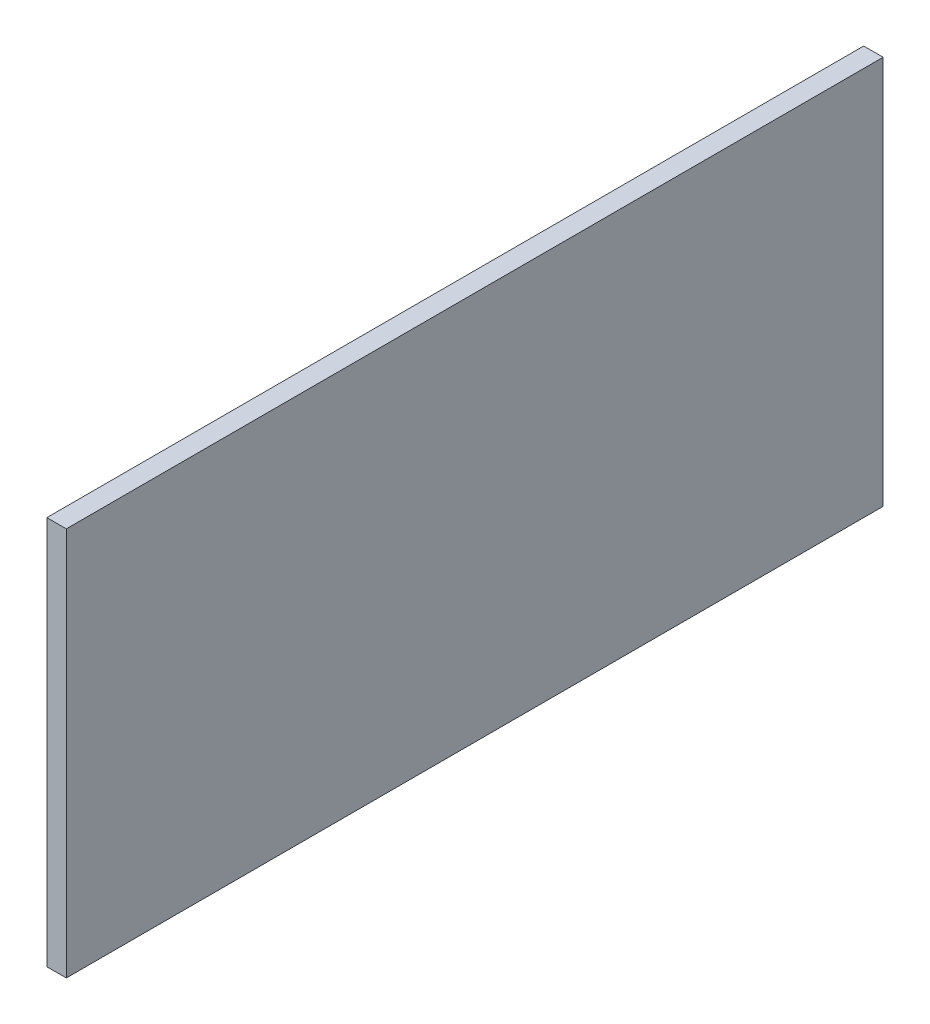
from build123d import *

# Parameters (mm, degrees)
ESQUISSE1_W        = 210
ESQUISSE1_H        = 100
BOSS_EXTRU_1_DEPTH = 5


with BuildPart() as part:
    # Esquisse1 → Boss.-Extru.1 (new body)
    with BuildSketch(Plane(origin=(0, 0, 0), x_dir=(0, 0, -1), z_dir=(1, 0, 0))):
        with Locations((52.675089606, -2.682258065)):
            Rectangle(ESQUISSE1_W, ESQUISSE1_H)
    extrude(amount=BOSS_EXTRU_1_DEPTH)


solid = part.part
